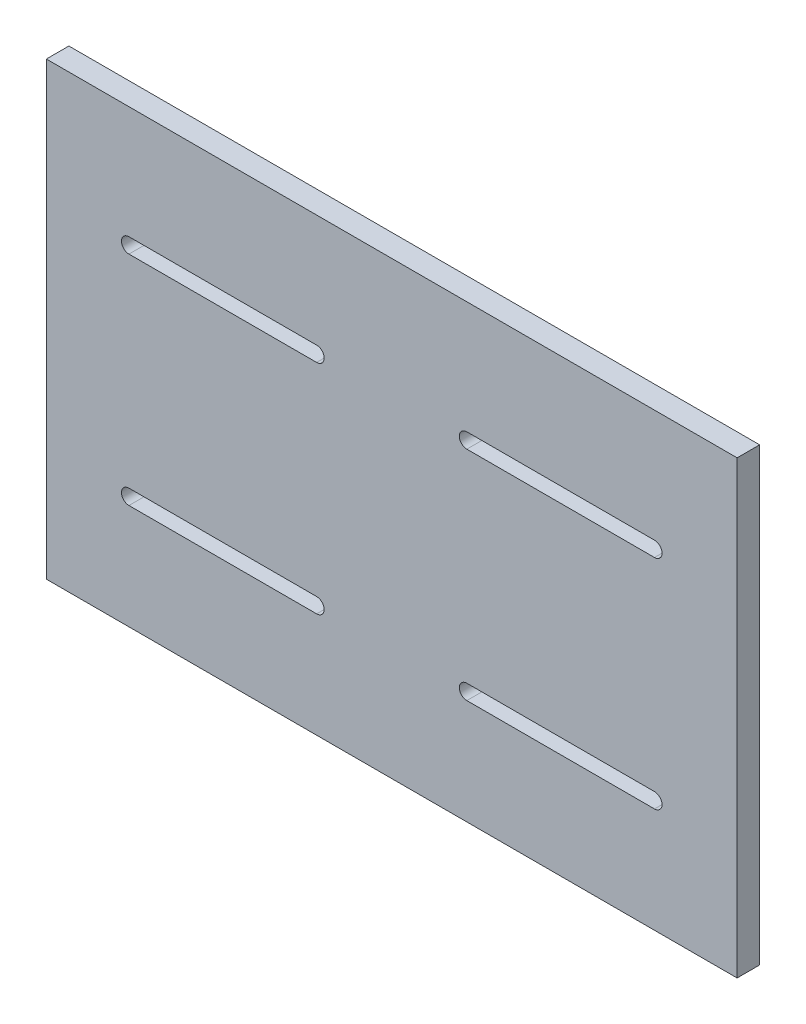
from build123d import *

# Parameters (mm, degrees)
SKETCH1_W           = 92
SKETCH1_H           = 60
BOSS_EXTRUDE1_DEPTH = 3
CUT_EXTRUDE1_DEPTH  = 3


with BuildPart() as part:
    # Sketch1 → Boss-Extrude1 (new body)
    with BuildSketch(Plane.XY):
        Rectangle(SKETCH1_W, SKETCH1_H)
    extrude(amount=BOSS_EXTRUDE1_DEPTH)

    # Sketch2 → Cut-Extrude1 (cut)
    with BuildSketch(Plane.XY.offset(3)):
        with BuildLine():
            Line((-35, 15), (-10, 15))
            ThreePointArc((-10, 15), (-9, 14), (-10, 13))
            Line((-10, 13), (-35, 13))
            ThreePointArc((-35, 13), (-36, 14), (-35, 15))
        make_face()
        with BuildLine():
            Line((-35, -14), (-10, -14))
            ThreePointArc((-10, -14), (-9, -15), (-10, -16))
            Line((-10, -16), (-35, -16))
            ThreePointArc((-35, -16), (-36, -15), (-35, -14))
        make_face()
        with BuildLine():
            Line((35, 13), (10, 13))
            ThreePointArc((10, 13), (9, 14), (10, 15))
            Line((10, 15), (35, 15))
            ThreePointArc((35, 15), (36, 14), (35, 13))
        make_face()
        with BuildLine():
            Line((35, -16), (10, -16))
            ThreePointArc((10, -16), (9, -15), (10, -14))
            Line((10, -14), (35, -14))
            ThreePointArc((35, -14), (36, -15), (35, -16))
        make_face()
    extrude(amount=-CUT_EXTRUDE1_DEPTH, mode=Mode.SUBTRACT)


solid = part.part
